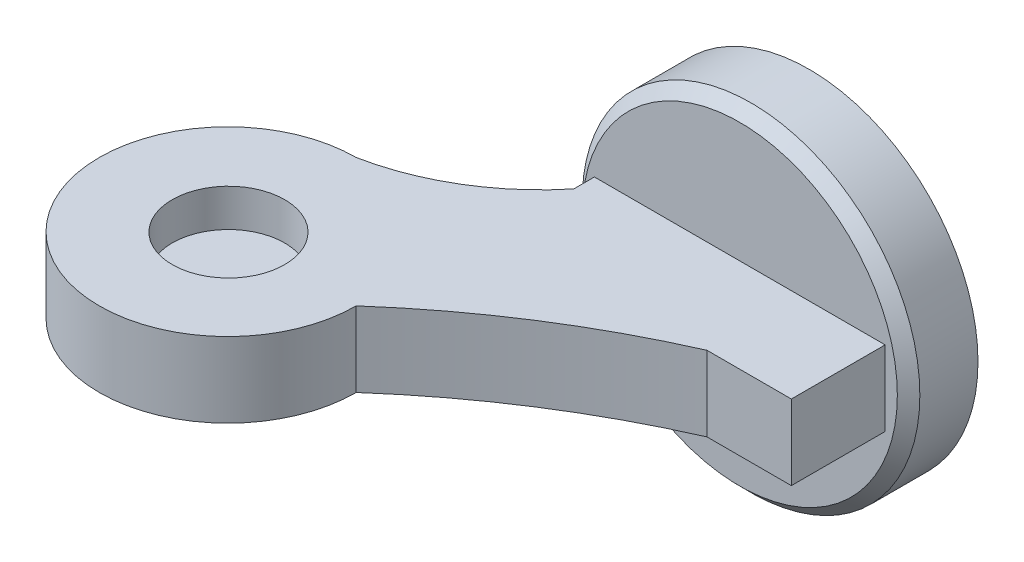
from build123d import *

# Parameters (mm, degrees)
SKETCH1_R                     = 90
BOSS_EXTRUDE1_DEPTH           = 37
CHAMFER1_SIZE                 = 6
SKETCH2_W                     = 155
SKETCH2_H                     = 40
BOSS_EXTRUDE2_DEPTH           = 50
CUT_EXTRUDE1_DEPTH            = 50
BOSS_EXTRUDE4_DEPTH           = 40
BOSS_EXTRUDE4_OTHER_WAY_DEPTH = 7.5
BOSS_EXTRUDE4_OTHER_WAY_DRAFT = 70
SKETCH5_R                     = 40
BOSS_EXTRUDE5_DEPTH           = 18
BOSS_EXTRUDE5_TAPER           = 28
CUT_EXTRUDE2_DEPTH            = 18
SKETCH9_R                     = 3
CUT_EXTRUDE4_DEPTH            = 20
CIRPATTERN1_COUNT             = 12
SKETCH11_R                    = 22.5
CUT_EXTRUDE5_DEPTH            = 2
CUT_EXTRUDE5_DRAFT            = -45
BOSS_EXTRUDE6_DEPTH           = 4
BOSS_EXTRUDE6_DRAFT           = 20
CIRPATTERN2_COPY_1_DEPTH      = 4
CIRPATTERN2_COPY_1_DRAFT      = 20
CIRPATTERN2_COPY_2_DEPTH      = 4
CIRPATTERN2_COPY_2_DRAFT      = 20
CIRPATTERN2_COPY_3_DEPTH      = 4
CIRPATTERN2_COPY_3_DRAFT      = 20
SKETCH14_R                    = 9.955880937
BOSS_EXTRUDE7_DEPTH           = 4
SKETCH16_R                    = 5
CUT_EXTRUDE6_DEPTH            = 4
SKETCH17_R                    = 30
CUT_EXTRUDE7_DEPTH            = 20
SKETCH18_R                    = 30
CUT_EXTRUDE8_DEPTH            = 20


with BuildPart() as part:
    # Sketch1 → Boss-Extrude1 (new body)
    with BuildSketch(Plane.XY):
        Circle(SKETCH1_R)
    extrude(amount=BOSS_EXTRUDE1_DEPTH)

    # Chamfer1
    chamfer1_edges = [part.edges().sort_by_distance(p)[0] for p in [
        (-90, 0, 37),
    ]]
    chamfer(chamfer1_edges, length=CHAMFER1_SIZE)

    # Sketch2 → Boss-Extrude2 (add)
    with BuildSketch(Plane.XY.offset(37)):
        Rectangle(SKETCH2_W, SKETCH2_H)
    extrude(amount=BOSS_EXTRUDE2_DEPTH)

    # Sketch3 → Cut-Extrude1 (cut)
    with BuildSketch(Plane.XZ.offset(20)):
        with BuildLine():
            Line((-77.5, 48), (-77.5, 87))
            Line((-77.5, 87), (32.5, 87))
            ThreePointArc((32.5, 87), (-18.551432041, 56.363013449), (-77.5, 48))
        make_face()
    extrude(amount=-CUT_EXTRUDE1_DEPTH, mode=Mode.SUBTRACT)

    # Sketch4 → Boss-Extrude4 (add)
    with BuildSketch(Plane(origin=(0, -20, 0), x_dir=(-1, 0, 0), z_dir=(0, -1, 0))):
        with BuildLine():
            ThreePointArc((81.5, -160), (198.436814511, -208.436814511), (150, -91.5))
            ThreePointArc((150, -91.5), (109.960480223, -76.065866296), (77.5, -48))
            ThreePointArc((77.5, -48), (18.551432041, -56.363013449), (-32.5, -87))
            ThreePointArc((-32.5, -87), (27.32419397, -119.089614896), (81.5, -160))
        make_face()
    extrude(amount=-BOSS_EXTRUDE4_DEPTH)


with BuildPart() as boss_extrude4_other_way_tool:
    # Sketch4 → Boss-Extrude4 other way (with draft: the straight prism first)
    with BuildSketch(Plane(origin=(0, -20, 0), x_dir=(-1, 0, 0), z_dir=(0, -1, 0))):
        with BuildLine():
            ThreePointArc((81.5, -160), (198.436814511, -208.436814511), (150, -91.5))
            ThreePointArc((150, -91.5), (109.960480223, -76.065866296), (77.5, -48))
            ThreePointArc((77.5, -48), (18.551432041, -56.363013449), (-32.5, -87))
            ThreePointArc((-32.5, -87), (27.32419397, -119.089614896), (81.5, -160))
        make_face()
    extrude(amount=BOSS_EXTRUDE4_OTHER_WAY_DEPTH)
    # Boss-Extrude4 other way: the draft: its side faces are tilted about the plane it starts from
    boss_extrude4_other_way_sides = [boss_extrude4_other_way_tool.faces().sort_by_distance(p)[0] for p in [
        (-109.960480223, -23.75, 76.065866296),
        (-18.551432041, -23.75, 56.363013449),
        (-27.32419397, -23.75, 119.089614896),
        (-198.436814511, -23.75, 208.436814511),
    ]]
    draft(boss_extrude4_other_way_sides, Plane(origin=(0, -20, 0), x_dir=(-1, 0, 0), z_dir=(0, -1, 0)), BOSS_EXTRUDE4_OTHER_WAY_DRAFT)


with BuildPart() as part_1:
    add(part.part)

    # Boss-Extrude4 other way: add boss_extrude4_other_way_tool
    add(boss_extrude4_other_way_tool.part)

    # Sketch5 → Boss-Extrude5 (add)
    with BuildSketch(Plane.XZ.offset(27.5)):
        with Locations((-149.593358881, 160)):
            Circle(SKETCH5_R)
    extrude(amount=BOSS_EXTRUDE5_DEPTH, taper=BOSS_EXTRUDE5_TAPER)

    # Sketch8 → Cut-Extrude2 (cut)
    with BuildSketch(Plane.XZ.offset(45.5)):
        with BuildLine():
            Line((-155.550765768, 199.553878485), (-143.635951994, 199.553878485))
            ThreePointArc((-143.635951994, 199.553878485), (-144.724878908, 193.757734993), (-149.593358881, 190.42923023))
            ThreePointArc((-149.593358881, 190.42923023), (-154.461838854, 193.757734993), (-155.550765768, 199.553878485))
        make_face()
    cut_extrude2 = extrude(amount=-CUT_EXTRUDE2_DEPTH, mode=Mode.SUBTRACT)

    # Sketch9 → Cut-Extrude4 (cut)
    with BuildSketch(Plane.XZ.offset(45.5)):
        with Locations((-149.593358881, 195.213397144)):
            Circle(SKETCH9_R)
    cut_extrude4 = extrude(amount=-CUT_EXTRUDE4_DEPTH, mode=Mode.SUBTRACT)

    # CirPattern1: Cut-Extrude2, Cut-Extrude4 ×12 about axis
    cirpattern1_axis = Axis((-149.593358881, 0, 160), (0, 1, 0))
    add([cut_extrude2.rotate(cirpattern1_axis, i * 360 / CIRPATTERN1_COUNT) for i in range(1, CIRPATTERN1_COUNT)], mode=Mode.SUBTRACT)
    add([cut_extrude4.rotate(cirpattern1_axis, i * 360 / CIRPATTERN1_COUNT) for i in range(1, CIRPATTERN1_COUNT)], mode=Mode.SUBTRACT)


with BuildPart() as cut_extrude5_tool:
    # Sketch11 → Cut-Extrude5 (with draft: the straight prism first)
    with BuildSketch(Plane.XZ.offset(45.5)):
        with Locations((-149.593358881, 160)):
            Circle(SKETCH11_R)
    extrude(amount=-CUT_EXTRUDE5_DEPTH)
    # Cut-Extrude5: the draft: its side faces are tilted about the plane it starts from
    cut_extrude5_sides = [cut_extrude5_tool.faces().sort_by_distance(p)[0] for p in [
        (-172.093358881, -44.5, 160),
    ]]
    draft(cut_extrude5_sides, Plane.XZ.offset(45.5), CUT_EXTRUDE5_DRAFT)


with BuildPart() as part_2:
    add(part_1.part)

    # Cut-Extrude5: cut by cut_extrude5_tool
    add(cut_extrude5_tool.part, mode=Mode.SUBTRACT)


with BuildPart() as boss_extrude6_tool:
    # Sketch12 → Boss-Extrude6 (with draft: the straight prism first)
    with BuildSketch(Plane.XZ.offset(43.5)):
        with BuildLine():
            ThreePointArc((-152.777514925, 167.881062764), (-149.593358881, 168.5), (-146.409202837, 167.881062764))
            Line((-146.409202837, 167.881062764), (-142.288530309, 178.080085164))
            ThreePointArc((-142.288530309, 178.080085164), (-149.593358881, 179.5), (-156.898187453, 178.080085164))
            Line((-156.898187453, 178.080085164), (-152.777514925, 167.881062764))
        make_face()
    extrude(amount=BOSS_EXTRUDE6_DEPTH)
    # Boss-Extrude6: the draft: its side faces are tilted about the plane it starts from
    boss_extrude6_sides = [boss_extrude6_tool.faces().sort_by_distance(p)[0] for p in [
        (-149.593358881, -45.5, 168.5),
        (-144.348866573, -45.5, 172.980573964),
        (-149.593358881, -45.5, 179.5),
        (-154.837851189, -45.5, 172.980573964),
    ]]
    draft(boss_extrude6_sides, Plane.XZ.offset(43.5), BOSS_EXTRUDE6_DRAFT)


with BuildPart() as part_3:
    add(part_2.part)

    # Boss-Extrude6: add boss_extrude6_tool
    add(boss_extrude6_tool.part)


with BuildPart() as cirpattern2_copy_1_tool:
    # CirPattern2 copy 1 sketch → CirPattern2 copy 1 (with draft: the straight prism first)
    with BuildSketch(Plane(origin=(-309.593358881, -43.5, 10.406641119), x_dir=(0, 0, -1), z_dir=(0, -1, 0))):
        with BuildLine():
            ThreePointArc((-152.777514925, 167.881062764), (-149.593358881, 168.5), (-146.409202837, 167.881062764))
            Line((-146.409202837, 167.881062764), (-142.288530309, 178.080085164))
            ThreePointArc((-142.288530309, 178.080085164), (-149.593358881, 179.5), (-156.898187453, 178.080085164))
            Line((-156.898187453, 178.080085164), (-152.777514925, 167.881062764))
        make_face()
    extrude(amount=CIRPATTERN2_COPY_1_DEPTH)
    # CirPattern2 copy 1: the draft: its side faces are tilted about the plane it starts from
    cirpattern2_copy_1_sides = [cirpattern2_copy_1_tool.faces().sort_by_distance(p)[0] for p in [
        (-141.093358881, -45.5, 160),
        (-136.612784917, -45.5, 154.755507692),
        (-130.093358881, -45.5, 160),
        (-136.612784917, -45.5, 165.244492308),
    ]]
    draft(cirpattern2_copy_1_sides, Plane(origin=(-309.593358881, -43.5, 10.406641119), x_dir=(0, 0, -1), z_dir=(0, -1, 0)), CIRPATTERN2_COPY_1_DRAFT)


with BuildPart() as part_4:
    add(part_3.part)

    # CirPattern2 copy 1: add cirpattern2_copy_1_tool
    add(cirpattern2_copy_1_tool.part)


with BuildPart() as cirpattern2_copy_2_tool:
    # CirPattern2 copy 2 sketch → CirPattern2 copy 2 (with draft: the straight prism first)
    with BuildSketch(Plane(origin=(-299.186717762, -43.5, 320), x_dir=(-1, 0, 0), z_dir=(0, -1, 0))):
        with BuildLine():
            ThreePointArc((-152.777514925, 167.881062764), (-149.593358881, 168.5), (-146.409202837, 167.881062764))
            Line((-146.409202837, 167.881062764), (-142.288530309, 178.080085164))
            ThreePointArc((-142.288530309, 178.080085164), (-149.593358881, 179.5), (-156.898187453, 178.080085164))
            Line((-156.898187453, 178.080085164), (-152.777514925, 167.881062764))
        make_face()
    extrude(amount=CIRPATTERN2_COPY_2_DEPTH)
    # CirPattern2 copy 2: the draft: its side faces are tilted about the plane it starts from
    cirpattern2_copy_2_sides = [cirpattern2_copy_2_tool.faces().sort_by_distance(p)[0] for p in [
        (-149.593358881, -45.5, 151.5),
        (-154.837851189, -45.5, 147.019426036),
        (-149.593358881, -45.5, 140.5),
        (-144.348866573, -45.5, 147.019426036),
    ]]
    draft(cirpattern2_copy_2_sides, Plane(origin=(-299.186717762, -43.5, 320), x_dir=(-1, 0, 0), z_dir=(0, -1, 0)), CIRPATTERN2_COPY_2_DRAFT)


with BuildPart() as part_5:
    add(part_4.part)

    # CirPattern2 copy 2: add cirpattern2_copy_2_tool
    add(cirpattern2_copy_2_tool.part)


with BuildPart() as cirpattern2_copy_3_tool:
    # CirPattern2 copy 3 sketch → CirPattern2 copy 3 (with draft: the straight prism first)
    with BuildSketch(Plane(origin=(10.406641119, -43.5, 309.593358881), x_dir=(0, 0, 1), z_dir=(0, -1, 0))):
        with BuildLine():
            ThreePointArc((-152.777514925, 167.881062764), (-149.593358881, 168.5), (-146.409202837, 167.881062764))
            Line((-146.409202837, 167.881062764), (-142.288530309, 178.080085164))
            ThreePointArc((-142.288530309, 178.080085164), (-149.593358881, 179.5), (-156.898187453, 178.080085164))
            Line((-156.898187453, 178.080085164), (-152.777514925, 167.881062764))
        make_face()
    extrude(amount=CIRPATTERN2_COPY_3_DEPTH)
    # CirPattern2 copy 3: the draft: its side faces are tilted about the plane it starts from
    cirpattern2_copy_3_sides = [cirpattern2_copy_3_tool.faces().sort_by_distance(p)[0] for p in [
        (-158.093358881, -45.5, 160),
        (-162.573932845, -45.5, 165.244492308),
        (-169.093358881, -45.5, 160),
        (-162.573932845, -45.5, 154.755507692),
    ]]
    draft(cirpattern2_copy_3_sides, Plane(origin=(10.406641119, -43.5, 309.593358881), x_dir=(0, 0, 1), z_dir=(0, -1, 0)), CIRPATTERN2_COPY_3_DRAFT)


with BuildPart() as part_6:
    add(part_5.part)

    # CirPattern2 copy 3: add cirpattern2_copy_3_tool
    add(cirpattern2_copy_3_tool.part)

    # Sketch14 → Boss-Extrude7 (add)
    with BuildSketch(Plane.XZ.offset(43.5)):
        with Locations((-149.593358881, 160)):
            Circle(SKETCH14_R)
    extrude(amount=BOSS_EXTRUDE7_DEPTH)

    # Sketch16 → Cut-Extrude6 (cut)
    with BuildSketch(Plane.XZ.offset(47.5)):
        with Locations((-149.593358881, 160)):
            Circle(SKETCH16_R)
    extrude(amount=-CUT_EXTRUDE6_DEPTH, mode=Mode.SUBTRACT)

    # Sketch17 → Cut-Extrude7 (cut)
    with BuildSketch(Plane(origin=(0, 20, 0), x_dir=(1, 0, 0), z_dir=(0, 1, 0))):
        with Locations(Location((-149.593358881, -160, 0), (0, 0, 180))):
            Circle(SKETCH17_R)
    extrude(amount=-CUT_EXTRUDE7_DEPTH, mode=Mode.SUBTRACT)

    # Sketch18 → Cut-Extrude8 (cut)
    with BuildSketch(Plane(origin=(0, 0, 0), x_dir=(-1, 0, 0), z_dir=(0, 0, -1))):
        Circle(SKETCH18_R)
    extrude(amount=-CUT_EXTRUDE8_DEPTH, mode=Mode.SUBTRACT)


solid = part_6.part
